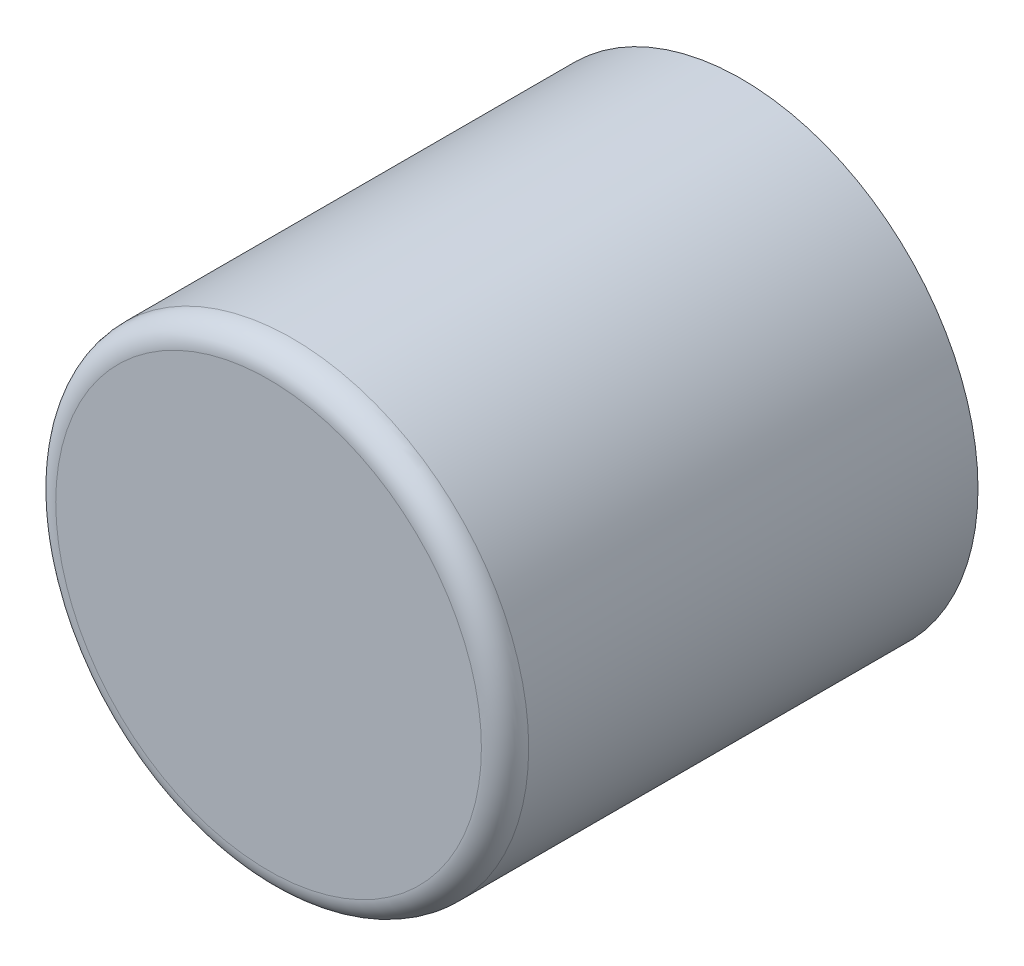
from build123d import *

# Parameters (mm, degrees)
SKETCH_1_R      = 1
EXTRUDE_1_DEPTH = 1
FILLET_1_R      = 0.1


with BuildPart() as part:
    # 草图1 → 凸台-拉伸1 (new, symmetric)
    with BuildSketch(Plane.XY):
        with Locations((0.667795602, 2.702625622)):
            Circle(SKETCH_1_R)
    extrude(amount=EXTRUDE_1_DEPTH, both=True)

    # 圆角1
    fillet_1_edges = [part.edges().sort_by_distance(p)[0] for p in [
        (-0.332204398, 2.702625622, 1),
    ]]
    fillet(fillet_1_edges, radius=FILLET_1_R)


solid = part.part
